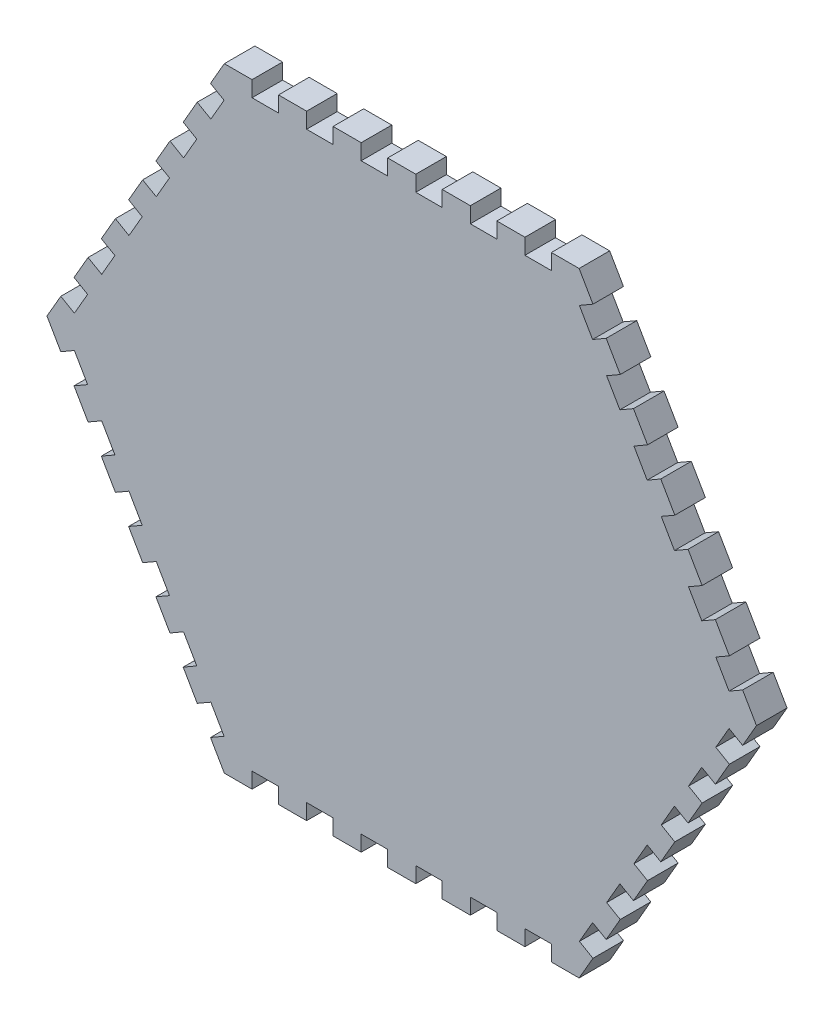
from build123d import *

# Parameters (mm, degrees)
ESTRUSIONE_ESTRUSIONE1_DEPTH = 5.6


with BuildPart() as part:
    # Schizzo1 → Estrusione-Estrusione1 (new body)
    with BuildSketch(Plane.XY):
        Polygon((-17.425, 53.416651246), (-17.425, 56.291651246), (-22.575, 56.291651246), (-22.575, 53.416651246), (-27.425, 53.416651246), (-27.425, 56.291651246), (-32.5, 56.291651246), (-35.0375, 51.896572322), (-32.547676964, 50.459072322), (-34.972676964, 46.258849113), (-37.4625, 47.696349113), (-40.0375, 43.236318284), (-37.547676964, 41.798818284), (-39.972676964, 37.598595076), (-42.4625, 39.036095076), (-45.0375, 34.576064246), (-42.547676964, 33.138564246), (-44.972676964, 28.938341038), (-47.4625, 30.375841038), (-50.0375, 25.915810208), (-47.547676964, 24.478310208), (-49.972676964, 20.278087), (-52.4625, 21.715587), (-55.0375, 17.25555617), (-52.547676964, 15.81805617), (-54.972676964, 11.617832962), (-57.4625, 13.055332962), (-60.0375, 8.595302133), (-57.547676964, 7.157802133), (-59.972676964, 2.957578924), (-62.4625, 4.395078924), (-65, 0), (-62.4625, -4.395078924), (-59.972676964, -2.957578924), (-57.547676964, -7.157802133), (-60.0375, -8.595302133), (-57.4625, -13.055332962), (-54.972676964, -11.617832962), (-52.547676964, -15.81805617), (-55.0375, -17.25555617), (-52.4625, -21.715587), (-49.972676964, -20.278087), (-47.547676964, -24.478310208), (-50.0375, -25.915810208), (-47.4625, -30.375841038), (-44.972676964, -28.938341038), (-42.547676964, -33.138564246), (-45.0375, -34.576064246), (-42.4625, -39.036095076), (-39.972676964, -37.598595076), (-37.547676964, -41.798818284), (-40.0375, -43.236318284), (-37.4625, -47.696349113), (-34.972676964, -46.258849113), (-32.547676964, -50.459072322), (-35.0375, -51.896572322), (-32.5, -56.291651246), (-27.425, -56.291651246), (-27.425, -53.416651246), (-22.575, -53.416651246), (-22.575, -56.291651246), (-17.425, -56.291651246), (-17.425, -53.416651246), (-12.575, -53.416651246), (-12.575, -56.291651246), (-7.425, -56.291651246), (-7.425, -53.416651246), (-2.575, -53.416651246), (-2.575, -56.291651246), (2.575, -56.291651246), (2.575, -53.416651246), (7.425, -53.416651246), (7.425, -56.291651246), (12.575, -56.291651246), (12.575, -53.416651246), (17.425, -53.416651246), (17.425, -56.291651246), (22.575, -56.291651246), (22.575, -53.416651246), (27.425, -53.416651246), (27.425, -56.291651246), (32.5, -56.291651246), (35.0375, -51.896572322), (32.547676964, -50.459072322), (34.972676964, -46.258849113), (37.4625, -47.696349113), (40.0375, -43.236318284), (37.547676964, -41.798818284), (39.972676964, -37.598595076), (42.4625, -39.036095076), (45.0375, -34.576064246), (42.547676964, -33.138564246), (44.972676964, -28.938341038), (47.4625, -30.375841038), (50.0375, -25.915810208), (47.547676964, -24.478310208), (49.972676964, -20.278087), (52.4625, -21.715587), (55.0375, -17.25555617), (52.547676964, -15.81805617), (54.972676964, -11.617832962), (57.4625, -13.055332962), (60.0375, -8.595302133), (57.547676964, -7.157802133), (59.972676964, -2.957578924), (62.4625, -4.395078924), (65, 0), (62.4625, 4.395078924), (59.972676964, 2.957578924), (57.547676964, 7.157802133), (60.0375, 8.595302133), (57.4625, 13.055332962), (54.972676964, 11.617832962), (52.547676964, 15.81805617), (55.0375, 17.25555617), (52.4625, 21.715587), (49.972676964, 20.278087), (47.547676964, 24.478310208), (50.0375, 25.915810208), (47.4625, 30.375841038), (44.972676964, 28.938341038), (42.547676964, 33.138564246), (45.0375, 34.576064246), (42.4625, 39.036095076), (39.972676964, 37.598595076), (37.547676964, 41.798818284), (40.0375, 43.236318284), (37.4625, 47.696349113), (34.972676964, 46.258849113), (32.547676964, 50.459072322), (35.0375, 51.896572322), (32.5, 56.291651246), (27.425, 56.291651246), (27.425, 53.416651246), (22.575, 53.416651246), (22.575, 56.291651246), (17.425, 56.291651246), (17.425, 53.416651246), (12.575, 53.416651246), (12.575, 56.291651246), (7.425, 56.291651246), (7.425, 53.416651246), (2.575, 53.416651246), (2.575, 56.291651246), (-2.575, 56.291651246), (-2.575, 53.416651246), (-7.425, 53.416651246), (-7.425, 56.291651246), (-12.575, 56.291651246), (-12.575, 53.416651246), align=None)
    extrude(amount=ESTRUSIONE_ESTRUSIONE1_DEPTH)


solid = part.part
